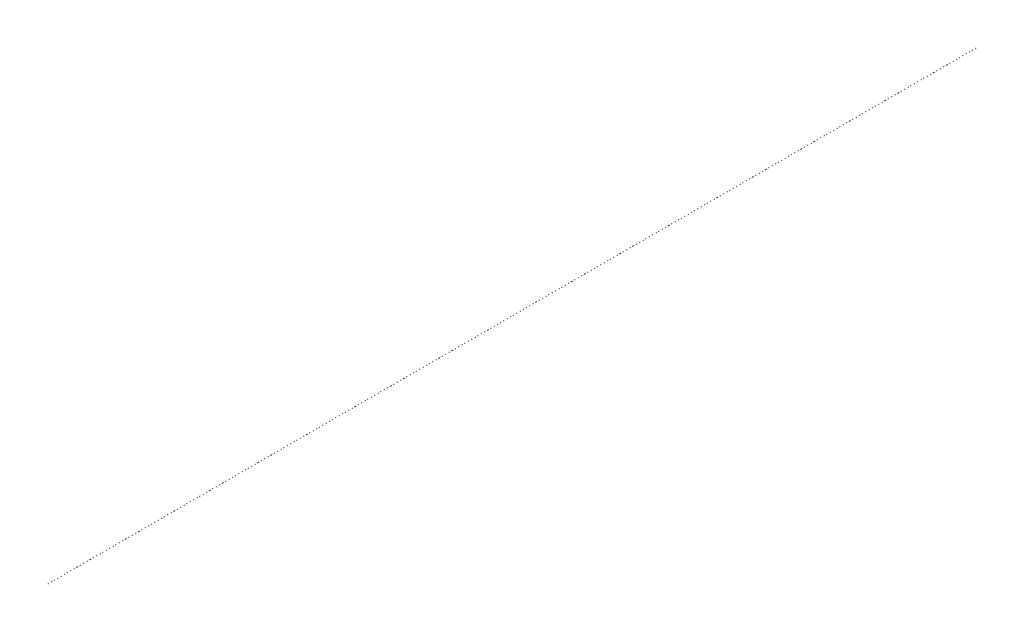
from build123d import *

# Parameters (mm, degrees)
BOSS_EXTRUDE1_DEPTH = 1234.095


with BuildPart() as part:
    # Sketch1 → Boss-Extrude1 (new body)
    with BuildSketch(Plane.XY):
        Polygon((-0.156931248, 0.004485316), (-0.057960722, -0.064978469), (0.008067023, 0.029096461), (-0.090903502, 0.098560246), align=None)
    extrude(amount=-BOSS_EXTRUDE1_DEPTH)

    # Mirror2: part across plane


with BuildPart() as part_1:
    add(part.part)
    add(part.part.mirror(Plane(origin=(0, 0, -1234.095), x_dir=(1, 0, 0), z_dir=(0, 0, -1))))


solid = part_1.part
